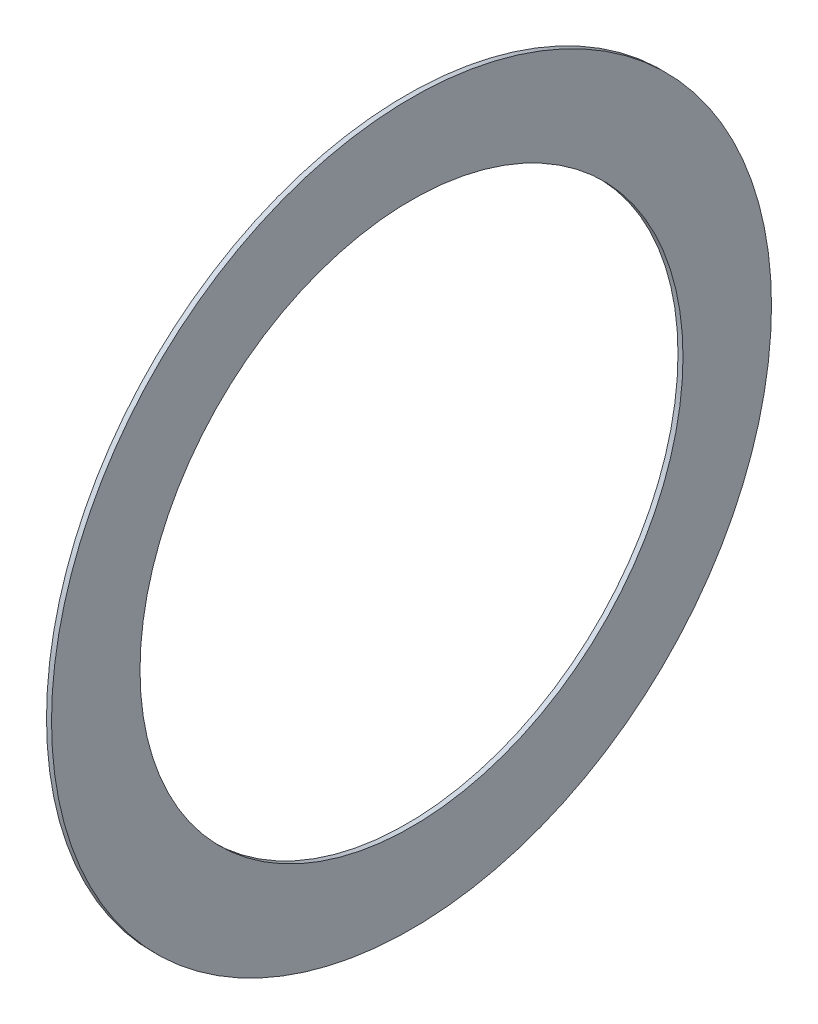
from build123d import *

# Parameters (mm, degrees)
SKETCH1_R           = 36
SKETCH1_R_2         = 27.15
BOSS_EXTRUDE1_DEPTH = 0.5


with BuildPart() as part:
    # Sketch1 → Boss-Extrude1 (new body)
    with BuildSketch(Plane(origin=(0, 0, 0), x_dir=(0, 0, -1), z_dir=(1, 0, 0))):
        Circle(SKETCH1_R)
        Circle(SKETCH1_R_2, mode=Mode.SUBTRACT)
    extrude(amount=BOSS_EXTRUDE1_DEPTH)


solid = part.part
